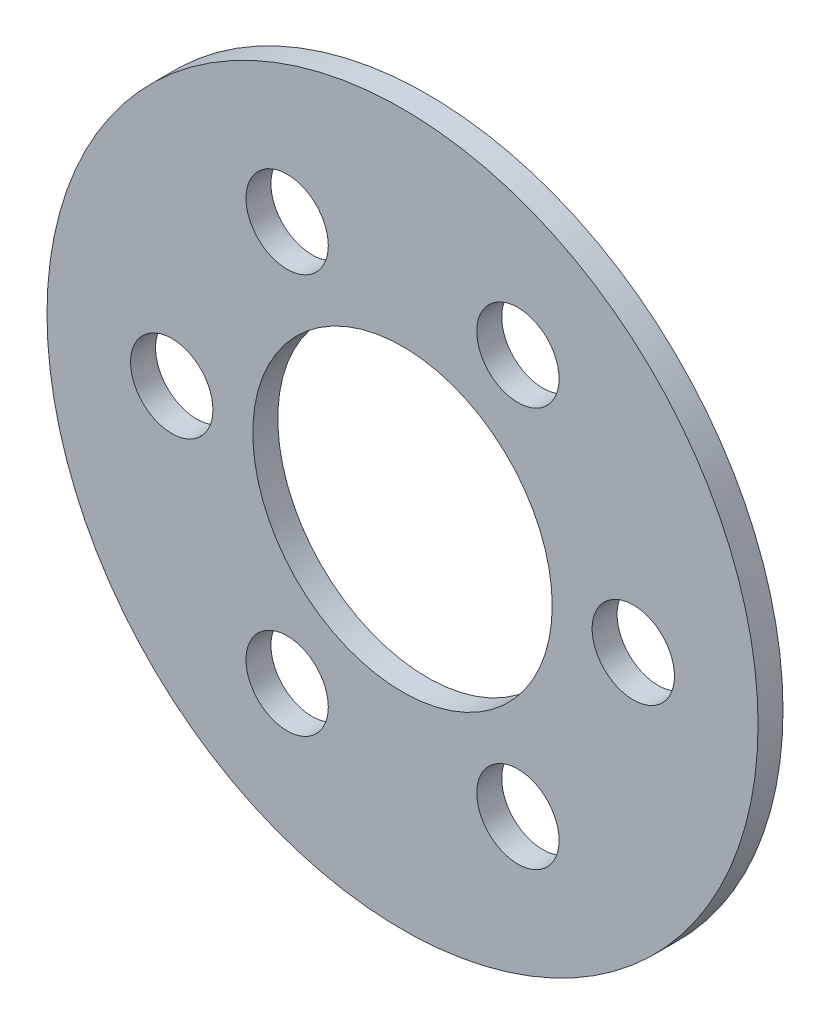
from build123d import *

# Parameters (mm, degrees)
SKIZZE1_R                       = 14.25
SKIZZE1_R_2                     = 6
SKIZZE1_R_3                     = 1.65
AUFSATZ_LINEAR_AUSTRAGEN1_DEPTH = 1


with BuildPart() as part:
    # Skizze1 → Aufsatz-Linear austragen1 (new body)
    with BuildSketch(Plane.XY):
        Circle(SKIZZE1_R)
        Circle(SKIZZE1_R_2, mode=Mode.SUBTRACT)
        with Locations((-9.25, 0)):
            Circle(SKIZZE1_R_3, mode=Mode.SUBTRACT)
        with Locations((-4.625, 8.010734985)):
            Circle(SKIZZE1_R_3, mode=Mode.SUBTRACT)
        with Locations((4.625, 8.010734985)):
            Circle(SKIZZE1_R_3, mode=Mode.SUBTRACT)
        with Locations((9.25, 0)):
            Circle(SKIZZE1_R_3, mode=Mode.SUBTRACT)
        with Locations((4.625, -8.010734985)):
            Circle(SKIZZE1_R_3, mode=Mode.SUBTRACT)
        with Locations((-4.625, -8.010734985)):
            Circle(SKIZZE1_R_3, mode=Mode.SUBTRACT)
    extrude(amount=AUFSATZ_LINEAR_AUSTRAGEN1_DEPTH)


solid = part.part
